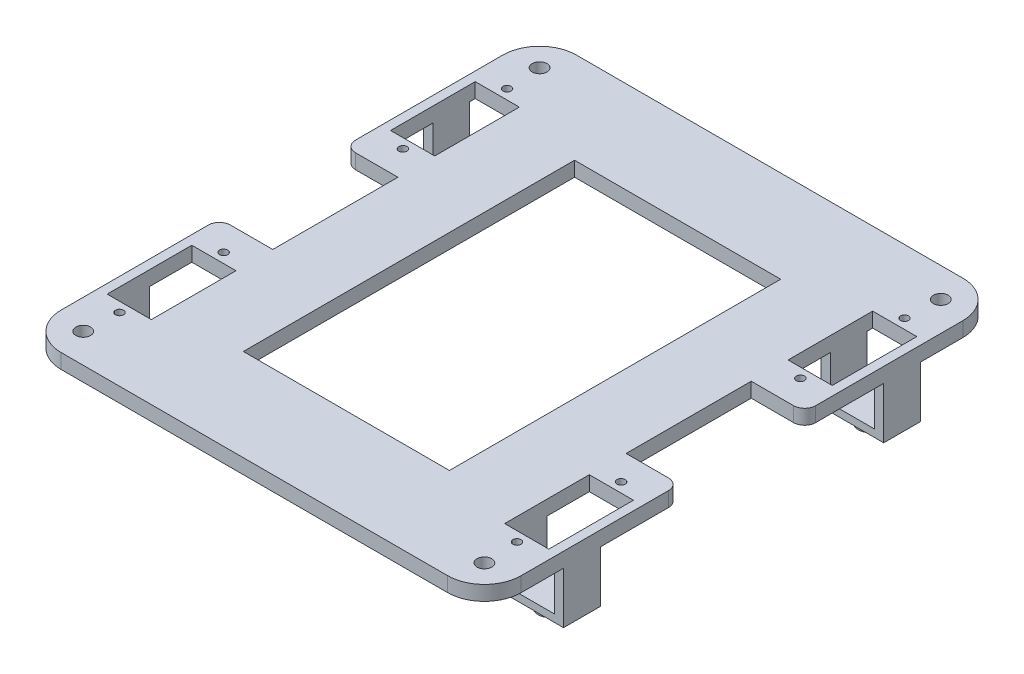
from build123d import *

# Parameters (mm, degrees)
SKETCH1_W           = 120
SKETCH1_H           = 140
BOSS_EXTRUDE1_DEPTH = 4
SKETCH2_W           = 12
SKETCH2_H           = 23
SKETCH2_H_2         = 34
SKETCH2_R           = 1.1
SKETCH2_R_2         = 2
CUT_EXTRUDE1_DEPTH  = 93.28217596
SKETCH3_W           = 2.5
SKETCH3_H           = 140
BOSS_EXTRUDE2_DEPTH = 4
SKETCH7_W           = 2.5
SKETCH7_H           = 10
BOSS_EXTRUDE6_DEPTH = 12
SKETCH8_W           = 17
SKETCH8_H           = 10
BOSS_EXTRUDE7_DEPTH = 2
SKETCH9_R           = 3.4
BOSS_EXTRUDE8_DEPTH = 2
SKETCH10_W          = 2.5
SKETCH10_H          = 34
CUT_EXTRUDE2_DEPTH  = 96.949205312
FILLET1_R           = 10
FILLET2_R           = 10
FILLET3_R           = 10
FILLET4_R           = 10
FILLET5_R           = 3
FILLET6_R           = 3
FILLET7_R           = 3
FILLET8_R           = 3
SKETCH11_W          = 56
SKETCH11_H          = 90
CUT_EXTRUDE3_DEPTH  = 96.949205312


with BuildPart() as part:
    # Sketch1 → Boss-Extrude1 (new body)
    with BuildSketch(Plane(origin=(0, 0, 0), x_dir=(1, 0, 0), z_dir=(0, 1, 0))):
        Rectangle(SKETCH1_W, SKETCH1_H)
    extrude(amount=BOSS_EXTRUDE1_DEPTH)

    # Sketch2 → Cut-Extrude1 (cut, through all)
    with BuildSketch(Plane(origin=(0, 4, 0), x_dir=(1, 0, 0), z_dir=(0, 1, 0))):
        with Locations((54, 38.5)):
            Rectangle(SKETCH2_W, SKETCH2_H)
        with Locations((-54, 38.5)):
            Rectangle(SKETCH2_W, SKETCH2_H)
        with Locations((54, -38.5)):
            Rectangle(SKETCH2_W, SKETCH2_H)
        with Locations((-54, -38.5)):
            Rectangle(SKETCH2_W, SKETCH2_H)
        with Locations((-54, 0)):
            Rectangle(SKETCH2_W, SKETCH2_H_2)
        with Locations((54, 0)):
            Rectangle(SKETCH2_W, SKETCH2_H_2)
        with Locations(Location((-54, 52.65, 0), (0, 0, 270))):
            Circle(SKETCH2_R)
        with Locations(Location((-54, 24.35, 0), (0, 0, 270))):
            Circle(SKETCH2_R)
        with Locations(Location((-54, -24.35, 0), (0, 0, 270))):
            Circle(SKETCH2_R)
        with Locations(Location((-54, -52.65, 0), (0, 0, 270))):
            Circle(SKETCH2_R)
        with Locations(Location((54, 52.65, 0), (0, 0, 270))):
            Circle(SKETCH2_R)
        with Locations(Location((54, 24.35, 0), (0, 0, 270))):
            Circle(SKETCH2_R)
        with Locations(Location((54, -24.35, 0), (0, 0, 270))):
            Circle(SKETCH2_R)
        with Locations(Location((54, -52.65, 0), (0, 0, 270))):
            Circle(SKETCH2_R)
        with Locations(Location((-54.5, 62, 0), (0, 0, 270))):
            Circle(SKETCH2_R_2)
        with Locations(Location((54.5, 62, 0), (0, 0, 270))):
            Circle(SKETCH2_R_2)
        with Locations(Location((54.5, -62, 0), (0, 0, 270))):
            Circle(SKETCH2_R_2)
        with Locations(Location((-54.5, -62, 0), (0, 0, 270))):
            Circle(SKETCH2_R_2)
    extrude(amount=-CUT_EXTRUDE1_DEPTH, mode=Mode.SUBTRACT)

    # Sketch3 → Boss-Extrude2 (add)
    with BuildSketch(Plane(origin=(0, 4, 0), x_dir=(1, 0, 0), z_dir=(0, 1, 0))):
        with Locations((61.25, 0)):
            Rectangle(SKETCH3_W, SKETCH3_H)
        with Locations((-61.25, 0)):
            Rectangle(SKETCH3_W, SKETCH3_H)
    extrude(amount=-BOSS_EXTRUDE2_DEPTH)

    # Sketch7 → Boss-Extrude6 (add)
    with BuildSketch(Plane.XZ):
        with Locations((46.75, 43.5)):
            Rectangle(SKETCH7_W, SKETCH7_H)
        with Locations((61.25, 43.5)):
            Rectangle(SKETCH7_W, SKETCH7_H)
        with Locations((-61.25, 43.5)):
            Rectangle(SKETCH7_W, SKETCH7_H)
        with Locations((-46.75, 43.5)):
            Rectangle(SKETCH7_W, SKETCH7_H)
        with Locations((-61.25, -43.5)):
            Rectangle(SKETCH7_W, SKETCH7_H)
        with Locations((-46.75, -43.5)):
            Rectangle(SKETCH7_W, SKETCH7_H)
        with Locations((46.75, -43.5)):
            Rectangle(SKETCH7_W, SKETCH7_H)
        with Locations((61.25, -43.5)):
            Rectangle(SKETCH7_W, SKETCH7_H)
    extrude(amount=BOSS_EXTRUDE6_DEPTH)

    # Sketch8 → Boss-Extrude7 (add)
    with BuildSketch(Plane.XZ.offset(12)):
        with Locations((-54, 43.5)):
            Rectangle(SKETCH8_W, SKETCH8_H)
        with Locations((-54, -43.5)):
            Rectangle(SKETCH8_W, SKETCH8_H)
        with Locations((54, -43.5)):
            Rectangle(SKETCH8_W, SKETCH8_H)
        with Locations((54, 43.5)):
            Rectangle(SKETCH8_W, SKETCH8_H)
    extrude(amount=BOSS_EXTRUDE7_DEPTH)

    # Sketch9 → Boss-Extrude8 (add)
    with BuildSketch(Plane.XZ.offset(14)):
        with Locations(Location((54, 43.5, 0), (0, 0, 270))):
            Circle(SKETCH9_R)
        with Locations(Location((-54, 43.5, 0), (0, 0, 270))):
            Circle(SKETCH9_R)
        with Locations(Location((-54, -43.5, 0), (0, 0, 270))):
            Circle(SKETCH9_R)
        with Locations(Location((54, -43.5, 0), (0, 0, 270))):
            Circle(SKETCH9_R)
    extrude(amount=BOSS_EXTRUDE8_DEPTH)

    # Sketch10 → Cut-Extrude2 (cut, through all)
    with BuildSketch(Plane(origin=(0, 4, 0), x_dir=(1, 0, 0), z_dir=(0, 1, 0))):
        with Locations((61.25, 0)):
            Rectangle(SKETCH10_W, SKETCH10_H)
        with Locations((-61.25, 0)):
            Rectangle(SKETCH10_W, SKETCH10_H)
    extrude(amount=-CUT_EXTRUDE2_DEPTH, mode=Mode.SUBTRACT)

    # Fillet1
    fillet1_edges = [part.edges().sort_by_distance(p)[0] for p in [
        (62.5, 2, -70),
    ]]
    fillet(fillet1_edges, radius=FILLET1_R)

    # Fillet2
    fillet2_edges = [part.edges().sort_by_distance(p)[0] for p in [
        (-62.5, 2, -70),
    ]]
    fillet(fillet2_edges, radius=FILLET2_R)

    # Fillet3
    fillet3_edges = [part.edges().sort_by_distance(p)[0] for p in [
        (-62.5, 2, 70),
    ]]
    fillet(fillet3_edges, radius=FILLET3_R)

    # Fillet4
    fillet4_edges = [part.edges().sort_by_distance(p)[0] for p in [
        (62.5, 2, 70),
    ]]
    fillet(fillet4_edges, radius=FILLET4_R)

    # Fillet5
    fillet5_edges = [part.edges().sort_by_distance(p)[0] for p in [
        (62.5, 2, -17),
    ]]
    fillet(fillet5_edges, radius=FILLET5_R)

    # Fillet6
    fillet6_edges = [part.edges().sort_by_distance(p)[0] for p in [
        (-62.5, 2, 17),
    ]]
    fillet(fillet6_edges, radius=FILLET6_R)

    # Fillet7
    fillet7_edges = [part.edges().sort_by_distance(p)[0] for p in [
        (62.5, 2, 17),
    ]]
    fillet(fillet7_edges, radius=FILLET7_R)

    # Fillet8
    fillet8_edges = [part.edges().sort_by_distance(p)[0] for p in [
        (-62.5, 2, -17),
    ]]
    fillet(fillet8_edges, radius=FILLET8_R)

    # Sketch11 → Cut-Extrude3 (cut, through all)
    with BuildSketch(Plane(origin=(0, 4, 0), x_dir=(1, 0, 0), z_dir=(0, 1, 0))):
        Rectangle(SKETCH11_W, SKETCH11_H)
    extrude(amount=-CUT_EXTRUDE3_DEPTH, mode=Mode.SUBTRACT)


solid = part.part
